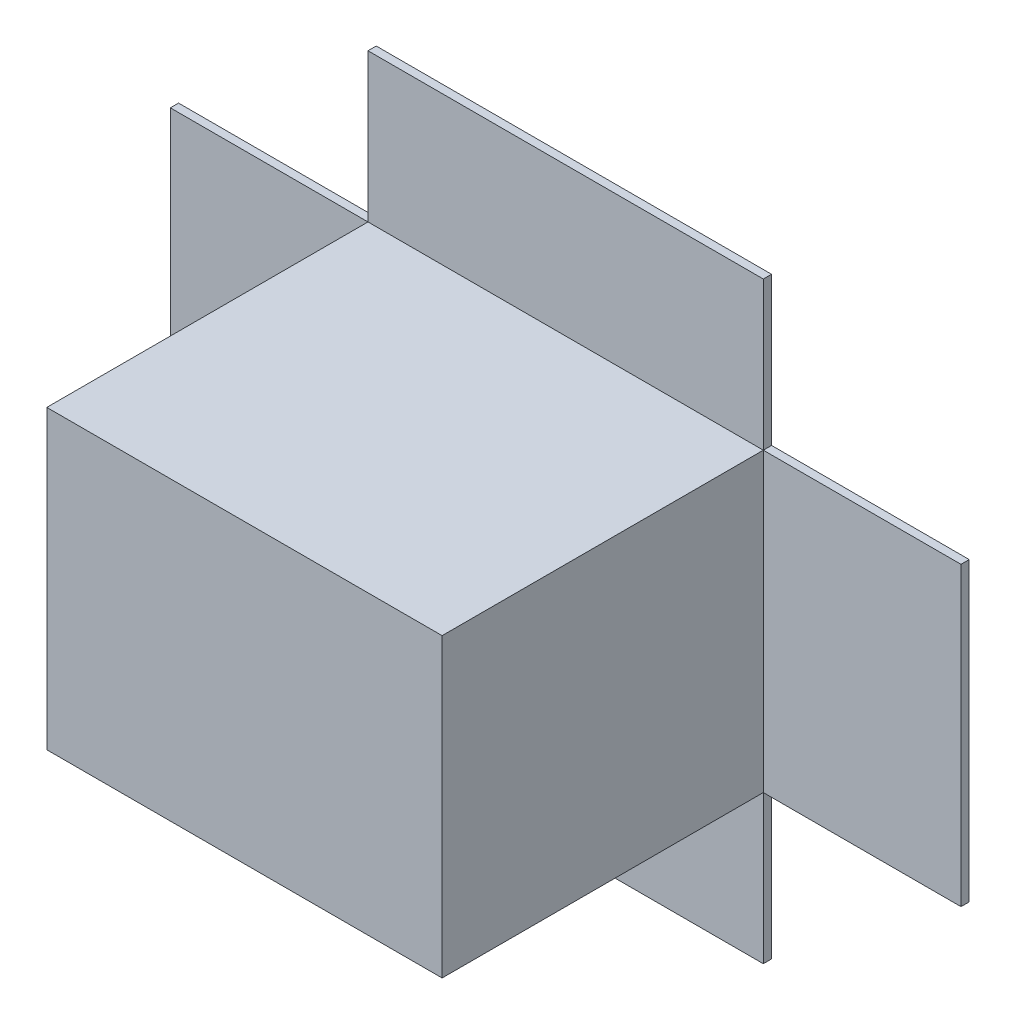
from build123d import *

# Parameters (mm, degrees)
CROQUIS1_W              = 120
CROQUIS1_H              = 90
SALIENTE_EXTRUIR1_DEPTH = 100
CROQUIS2_W              = 115
CROQUIS2_H              = 85
CORTAR_EXTRUIR1_DEPTH   = 97.5
CROQUIS3_W              = 60
CROQUIS3_H              = 90
CROQUIS3_W_2            = 120
CROQUIS3_H_2            = 45
CROQUIS3_W_3            = 115
CROQUIS3_H_3            = 85
SALIENTE_EXTRUIR2_DEPTH = 2.5


with BuildPart() as part:
    # Croquis1 → Saliente-Extruir1 (new body)
    with BuildSketch(Plane.XY):
        Rectangle(CROQUIS1_W, CROQUIS1_H)
    extrude(amount=SALIENTE_EXTRUIR1_DEPTH)

    # Croquis2 → Cortar-Extruir1 (cut)
    with BuildSketch(Plane(origin=(0, 0, 0), x_dir=(-1, 0, 0), z_dir=(0, 0, -1))):
        Rectangle(CROQUIS2_W, CROQUIS2_H)
    extrude(amount=-CORTAR_EXTRUIR1_DEPTH, mode=Mode.SUBTRACT)

    # Croquis3 → Saliente-Extruir2 (add)
    # profile 1 of 5: a face of its own
    with BuildSketch(Plane(origin=(0, 0, 0), x_dir=(-1, 0, 0), z_dir=(0, 0, -1))):
        with Locations((-90, 0)):
            Rectangle(CROQUIS3_W, CROQUIS3_H)
    # profile 2 of 5: a face of its own
    with BuildSketch(Plane(origin=(0, 0, 0), x_dir=(-1, 0, 0), z_dir=(0, 0, -1))):
        with Locations((0, 67.5)):
            Rectangle(CROQUIS3_W_2, CROQUIS3_H_2)
    # profile 3 of 5: a face of its own
    with BuildSketch(Plane(origin=(0, 0, 0), x_dir=(-1, 0, 0), z_dir=(0, 0, -1))):
        Rectangle(CROQUIS3_W_2, CROQUIS3_H)
        Rectangle(CROQUIS3_W_3, CROQUIS3_H_3, mode=Mode.SUBTRACT)
    # profile 4 of 5: a face of its own
    with BuildSketch(Plane(origin=(0, 0, 0), x_dir=(-1, 0, 0), z_dir=(0, 0, -1))):
        with Locations((90, 0)):
            Rectangle(CROQUIS3_W, CROQUIS3_H)
    # profile 5 of 5: a face of its own
    with BuildSketch(Plane(origin=(0, 0, 0), x_dir=(-1, 0, 0), z_dir=(0, 0, -1))):
        with Locations((0, -67.5)):
            Rectangle(CROQUIS3_W_2, CROQUIS3_H_2)
    extrude(amount=-SALIENTE_EXTRUIR2_DEPTH)


solid = part.part
